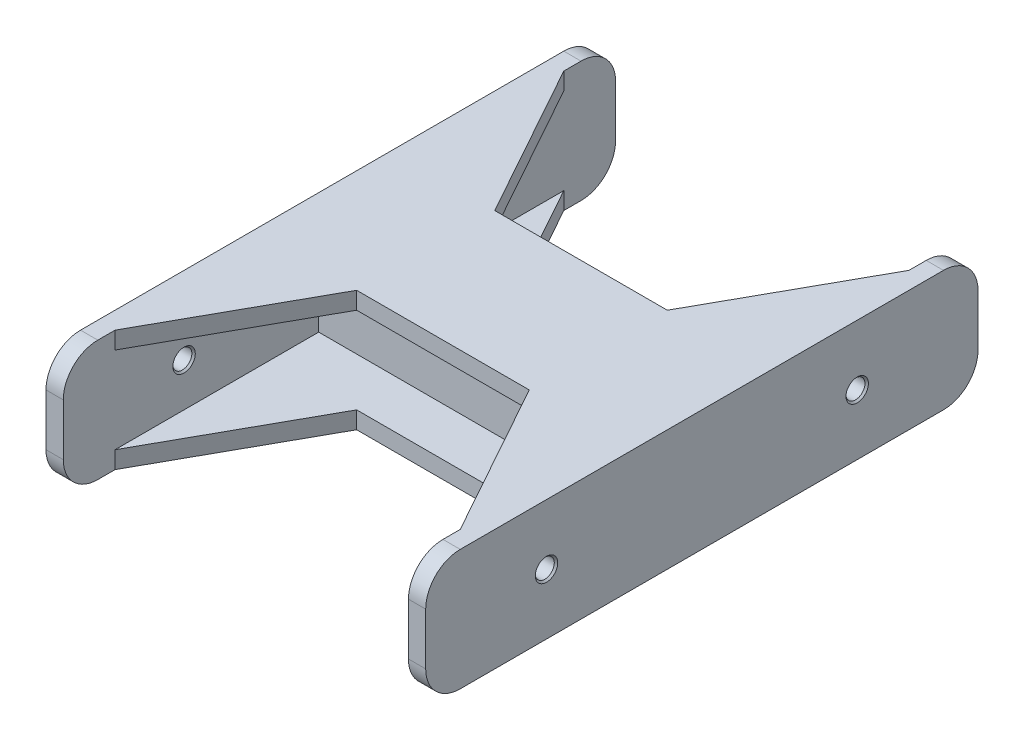
from build123d import *

# Parameters (mm, degrees)
SKETCH_1_W          = 160
SKETCH_1_H          = 20
EXTRUDE_1_DEPTH     = 5
EXTRUDE_3_DEPTH     = 100
SKETCH_5_W          = 12
SKETCH_5_H          = 15
EXTRUDE_4_DEPTH     = 105
SKETCH_6_W          = 74
SKETCH_6_H          = 15
EXTRUDE_5_DEPTH     = 5
SKETCH_7_W          = 160
SKETCH_7_H          = 35
EXTRUDE_6_DEPTH     = 5
EXTRUDE_7_DEPTH     = 5
SKETCH_9_R          = 2.75
CUT_EXTRUDE_1_DEPTH = 138.477270849
CHAMFER_1_SIZE      = 0.5
FILLET_1_R          = 10
EXTRUDE_8_DEPTH     = 5
FILLET_2_R          = 10


with BuildPart() as part:
    # 草图1 → 凸台-拉伸1 (new body)
    with BuildSketch(Plane(origin=(0, 0, 0), x_dir=(0, 0, -1), z_dir=(1, 0, 0))):
        with Locations((0, -5)):
            Rectangle(SKETCH_1_W, SKETCH_1_H)
    extrude(amount=EXTRUDE_1_DEPTH)

    # 草图3 → 凸台-拉伸3 (add)
    with BuildSketch(Plane(origin=(5, 0, 0), x_dir=(0, 0, -1), z_dir=(1, 0, 0))):
        Polygon((-6, 5), (6, 5), (6, -10), (20, -10), (20, -15), (-20, -15), (-20, -10), (-6, -10), align=None)
    extrude(amount=EXTRUDE_3_DEPTH)

    # 草图5 → 凸台-拉伸4 (add)
    with BuildSketch(Plane.ZY):
        with Locations((0, 12.5)):
            Rectangle(SKETCH_5_W, SKETCH_5_H)
    extrude(amount=-EXTRUDE_4_DEPTH)

    # 草图6 → 凸台-拉伸5 (add)
    with BuildSketch(Plane.ZY):
        with Locations((43, 12.5)):
            Rectangle(SKETCH_6_W, SKETCH_6_H)
        with Locations((-43, 12.5)):
            Rectangle(SKETCH_6_W, SKETCH_6_H)
    extrude(amount=-EXTRUDE_5_DEPTH)

    # 草图7 → 凸台-拉伸6 (add)
    with BuildSketch(Plane(origin=(105, 0, 0), x_dir=(0, 0, -1), z_dir=(1, 0, 0))):
        with Locations((0, 2.5)):
            Rectangle(SKETCH_7_W, SKETCH_7_H)
    extrude(amount=EXTRUDE_6_DEPTH)

    # 草图8 → 凸台-拉伸7 (add)
    with BuildSketch(Plane.XZ.offset(15)):
        Polygon((80, 20), (105, 65), (105, 20), align=None)
        Polygon((105, -20), (80, -20), (105, -65), align=None)
        Polygon((5, 20), (30, 20), (5, 65), align=None)
        Polygon((30, -20), (5, -65), (5, -20), align=None)
    extrude(amount=-EXTRUDE_7_DEPTH)

    # 草图9 → 切除-拉伸1 (cut, through all)
    with BuildSketch(Plane(origin=(110, 0, 0), x_dir=(0, 0, -1), z_dir=(1, 0, 0))):
        with Locations((45, 2.5)):
            Circle(SKETCH_9_R)
        with Locations(Location((-45, 2.5, 0), (0, 0, 180))):
            Circle(SKETCH_9_R)
    extrude(amount=-CUT_EXTRUDE_1_DEPTH, mode=Mode.SUBTRACT)

    # 倒角1
    chamfer_1_edges = [part.edges().sort_by_distance(p)[0] for p in [
        (105, 2.5, -42.25),
        (5, 2.5, -42.25),
        (0, 2.5, -42.25),
        (110, 2.5, -42.25),
        (105, 2.5, 42.25),
        (5, 2.5, 42.25),
        (0, 2.5, 42.25),
        (110, 2.5, 42.25),
    ]]
    chamfer(chamfer_1_edges, length=CHAMFER_1_SIZE)

    # 圆角1
    fillet_1_edges = [part.edges().sort_by_distance(p)[0] for p in [
        (107.5, -15, 80),
        (107.5, -15, -80),
        (2.5, -15, -80),
        (2.5, -15, 80),
    ]]
    fillet(fillet_1_edges, radius=FILLET_1_R)

    # 草图10 → 凸台-拉伸8 (add)
    with BuildSketch(Plane(origin=(0, 20, 0), x_dir=(1, 0, 0), z_dir=(0, 1, 0))):
        Polygon((5, 65), (5, 6), (105, 6), (105, 65), (80, 20), (30, 20), align=None)
        Polygon((5, -6), (5, -65), (30, -20), (80, -20), (105, -65), (105, -6), align=None)
    extrude(amount=-EXTRUDE_8_DEPTH)

    # 圆角2
    fillet_2_edges = [part.edges().sort_by_distance(p)[0] for p in [
        (2.5, 20, 80),
        (2.5, 20, -80),
        (107.5, 20, 80),
        (107.5, 20, -80),
    ]]
    fillet(fillet_2_edges, radius=FILLET_2_R)


solid = part.part
